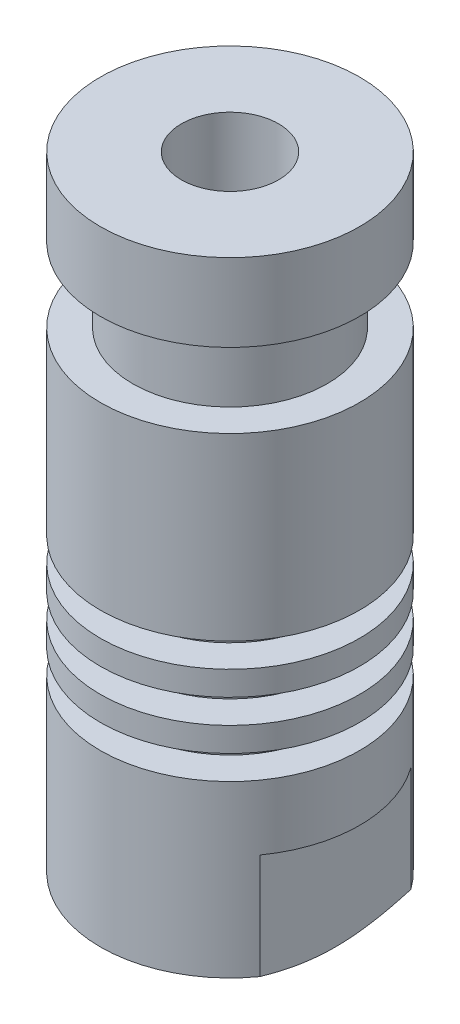
from build123d import *

# Parameters (mm, degrees)
TAGLIO_ESTRUSIONE1_REACH                  = 43.569
TAGLIO_ESTRUSIONE1_END_RADIUS             = 8
SCHIZZO2_W                                = 1.5
SCHIZZO2_H                                = 8
TAGLIO_ESTRUSIONE1_DIRECTION_2_REACH      = 43.569
TAGLIO_ESTRUSIONE1_DIRECTION_2_END_RADIUS = 8
SCHIZZO7_R                                = 3
TAGLIO_ESTRUSIONE2_DEPTH                  = 42.569219382
FORO_FILETTATO_M8_1_D                     = 6.8
FORO_FILETTATO_M8_1_DEPTH                 = 12
FORO_FILETTATO_M8_1_TIP                   = 2.042926105


with BuildPart() as part:
    # Schizzo1 → Rivoluzione1 (revolve)
    with BuildSketch(Plane.XY, mode=Mode.PRIVATE) as rivoluzione1_sk:
        Polygon((0, 0), (-5, 0), (-8, 1.5), (-8, 12), (-6, 12), (-6, 13.5), (-8, 13.5), (-8, 15), (-6, 15), (-6, 16.5), (-8, 16.5), (-8, 18), (-6, 18), (-6, 19.5), (-8, 19.5), (-8, 30.6), (-6, 30.6), (-6, 35.2), (-8, 35.2), (-8, 40), (0, 40), align=None)
    revolve(rivoluzione1_sk.sketch.rotate(Axis((0, 129.407380346, 0), (0, -1, 0)), 270), axis=Axis((0, 129.407380346, 0), (0, -1, 0)))

    # Taglio-Estrusione1: up to this cylinder (the profile starts inside it)
    taglio_estrusione1_end = Plane(origin=(0, 4, 0), z_dir=(0, 1, 0)) * Cylinder(TAGLIO_ESTRUSIONE1_END_RADIUS, 104.138, mode=Mode.PRIVATE)
    # Schizzo2 → Taglio-Estrusione1 (cut, up to the surface)
    with BuildSketch(Plane.XY, mode=Mode.PRIVATE) as taglio_estrusione1_sk1:
        with Locations((-7.25, 4)):
            Rectangle(SCHIZZO2_W, SCHIZZO2_H)
    taglio_estrusione1_tool1 = extrude(taglio_estrusione1_sk1.sketch, amount=-TAGLIO_ESTRUSIONE1_REACH, mode=Mode.PRIVATE) & taglio_estrusione1_end
    add(taglio_estrusione1_tool1.solids().sort_by_distance((-7.25, 4, 0))[0], mode=Mode.SUBTRACT)
    # Schizzo2 → Taglio-Estrusione1 (cut, up to the surface)
    with BuildSketch(Plane.XY, mode=Mode.PRIVATE) as taglio_estrusione1_sk2:
        with Locations((7.25, 4)):
            Rectangle(SCHIZZO2_W, SCHIZZO2_H)
    taglio_estrusione1_tool2 = extrude(taglio_estrusione1_sk2.sketch, amount=-TAGLIO_ESTRUSIONE1_REACH, mode=Mode.PRIVATE) & taglio_estrusione1_end
    add(taglio_estrusione1_tool2.solids().sort_by_distance((7.25, 4, 0))[0], mode=Mode.SUBTRACT)

    # Taglio-Estrusione1 direction 2: up to this cylinder (the profile starts inside it)
    taglio_estrusione1_direction_2_end = Plane(origin=(0, 4, 0), z_dir=(0, 1, 0)) * Cylinder(TAGLIO_ESTRUSIONE1_DIRECTION_2_END_RADIUS, 104.138, mode=Mode.PRIVATE)
    # Schizzo2 → Taglio-Estrusione1 direction 2 (cut, up to the surface)
    with BuildSketch(Plane.XY, mode=Mode.PRIVATE) as taglio_estrusione1_direction_2_sk1:
        with Locations((-7.25, 4)):
            Rectangle(SCHIZZO2_W, SCHIZZO2_H)
    taglio_estrusione1_direction_2_tool1 = extrude(taglio_estrusione1_direction_2_sk1.sketch, amount=TAGLIO_ESTRUSIONE1_DIRECTION_2_REACH, mode=Mode.PRIVATE) & taglio_estrusione1_direction_2_end
    add(taglio_estrusione1_direction_2_tool1.solids().sort_by_distance((-7.25, 4, 0))[0], mode=Mode.SUBTRACT)
    # Schizzo2 → Taglio-Estrusione1 direction 2 (cut, up to the surface)
    with BuildSketch(Plane.XY, mode=Mode.PRIVATE) as taglio_estrusione1_direction_2_sk2:
        with Locations((7.25, 4)):
            Rectangle(SCHIZZO2_W, SCHIZZO2_H)
    taglio_estrusione1_direction_2_tool2 = extrude(taglio_estrusione1_direction_2_sk2.sketch, amount=TAGLIO_ESTRUSIONE1_DIRECTION_2_REACH, mode=Mode.PRIVATE) & taglio_estrusione1_direction_2_end
    add(taglio_estrusione1_direction_2_tool2.solids().sort_by_distance((7.25, 4, 0))[0], mode=Mode.SUBTRACT)

    # Schizzo7 → Taglio-Estrusione2 (cut, through all)
    with BuildSketch(Plane(origin=(0, 40, 0), x_dir=(1, 0, 0), z_dir=(0, 1, 0))):
        with Locations(Location((0, 0, 0), (0, 0, 270))):
            Circle(SCHIZZO7_R)
    extrude(amount=-TAGLIO_ESTRUSIONE2_DEPTH, mode=Mode.SUBTRACT)

    # Foro filettato M8-1
    with Locations(Plane(origin=(0, 0, 0), x_dir=(-1, 0, 0), z_dir=(0, -1, 0))):
        with Locations((0, 0)):
            Hole(FORO_FILETTATO_M8_1_D / 2, depth=FORO_FILETTATO_M8_1_DEPTH)
            with Locations((0, 0, -(FORO_FILETTATO_M8_1_DEPTH + FORO_FILETTATO_M8_1_TIP / 2))):  # 118° drill point
                Cone(0, FORO_FILETTATO_M8_1_D / 2, FORO_FILETTATO_M8_1_TIP, mode=Mode.SUBTRACT)


solid = part.part
